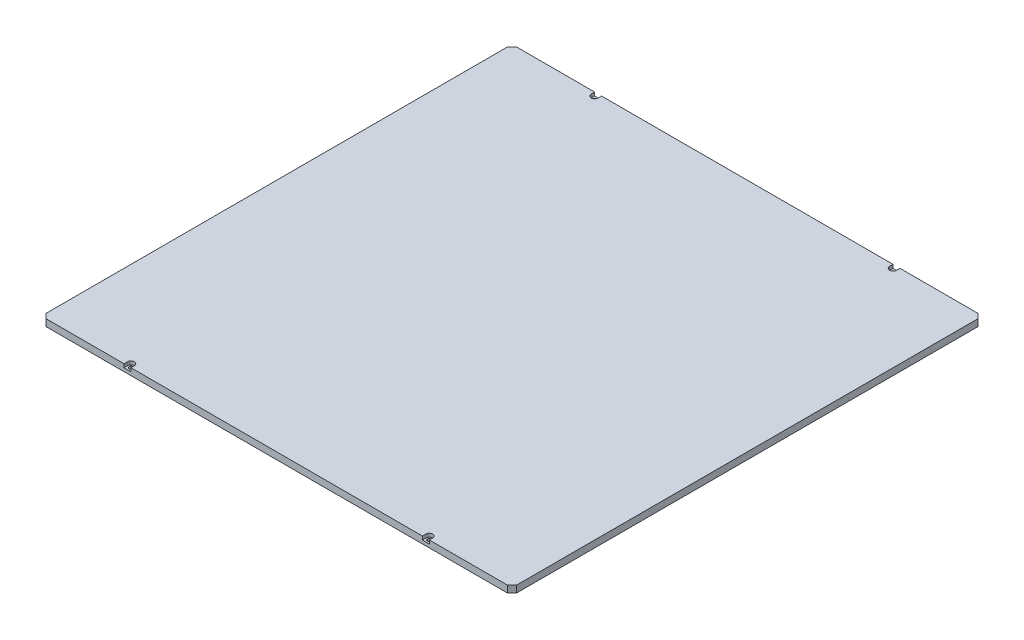
from build123d import *

# Parameters (mm, degrees)
SKETCH1_W           = 410
SKETCH1_H           = 410
BOSS_EXTRUDE1_DEPTH = 3
CHAMFER1_SIZE       = 4
CUT_EXTRUDE1_DEPTH  = 3
SKETCH3_R           = 1.65
CUT_EXTRUDE2_DEPTH  = 290.929301727


with BuildPart() as part:
    # Sketch1 → Boss-Extrude1 (new, symmetric)
    with BuildSketch(Plane(origin=(0, 0, 0), x_dir=(1, 0, 0), z_dir=(0, 1, 0))):
        Rectangle(SKETCH1_W, SKETCH1_H)
    extrude(amount=BOSS_EXTRUDE1_DEPTH, both=True)

    # Chamfer1
    chamfer1_edges = [part.edges().sort_by_distance(p)[0] for p in [
        (-205, 0, -205),
        (205, 0, -205),
        (205, 0, 205),
        (-205, 0, 205),
    ]]
    chamfer(chamfer1_edges, length=CHAMFER1_SIZE)

    # Sketch2 → Cut-Extrude1 (cut)
    with BuildSketch(Plane(origin=(0, 3, 0), x_dir=(1, 0, 0), z_dir=(0, 1, 0))):
        with BuildLine():
            Line((-133, 202), (-133, 205))
            Line((-133, 205), (-127, 205))
            Line((-127, 205), (-127, 202))
            ThreePointArc((-127, 202), (-130, 199), (-133, 202))
        make_face()
        with BuildLine():
            Line((127, 202), (127, 205))
            Line((127, 205), (133, 205))
            Line((133, 205), (133, 202))
            ThreePointArc((133, 202), (130, 199), (127, 202))
        make_face()
        with BuildLine():
            Line((-133, -202), (-133, -205))
            Line((-133, -205), (-127, -205))
            Line((-127, -205), (-127, -202))
            ThreePointArc((-127, -202), (-130, -199), (-133, -202))
        make_face()
        with BuildLine():
            Line((127, -202), (127, -205))
            Line((127, -205), (133, -205))
            Line((133, -205), (133, -202))
            ThreePointArc((133, -202), (130, -199), (127, -202))
        make_face()
    extrude(amount=-CUT_EXTRUDE1_DEPTH, mode=Mode.SUBTRACT)

    # Sketch3 → Cut-Extrude2 (cut, through all)
    with BuildSketch(Plane(origin=(0, 0, 0), x_dir=(1, 0, 0), z_dir=(0, 1, 0))):
        with Locations(Location((-130, -202, 0), (0, 0, 270))):
            Circle(SKETCH3_R)
        with Locations(Location((130, -202, 0), (0, 0, 270))):
            Circle(SKETCH3_R)
        with Locations(Location((130, 202, 0), (0, 0, 270))):
            Circle(SKETCH3_R)
        with Locations(Location((-130, 202, 0), (0, 0, 270))):
            Circle(SKETCH3_R)
    extrude(amount=-CUT_EXTRUDE2_DEPTH, mode=Mode.SUBTRACT)


solid = part.part
